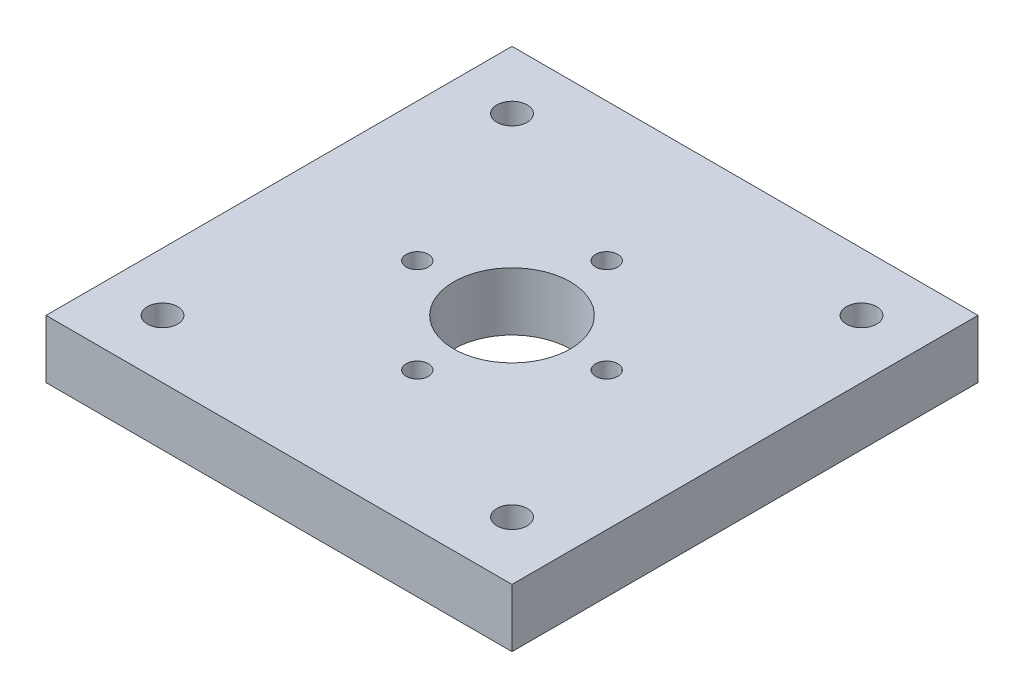
from build123d import *

# Parameters (mm, degrees)
SKETCH1_W           = 4
SKETCH1_H           = 4
BOSS_EXTRUDE1_DEPTH = 0.5
SKETCH2_R           = 0.13
CUT_EXTRUDE1_DEPTH  = 0.5
SKETCH3_R           = 0.5
CUT_EXTRUDE2_DEPTH  = 0.5
SKETCH4_R           = 0.095
CUT_EXTRUDE3_DEPTH  = 3.872281323
CIRPATTERN1_COUNT   = 4


with BuildPart() as part:
    # Sketch1 → Boss-Extrude1 (new body)
    with BuildSketch(Plane(origin=(0, 0, 0), x_dir=(1, 0, 0), z_dir=(0, 1, 0))):
        Rectangle(SKETCH1_W, SKETCH1_H)
    extrude(amount=BOSS_EXTRUDE1_DEPTH)

    # Sketch2 → Cut-Extrude1 (cut)
    with BuildSketch(Plane(origin=(0, 0.5, 0), x_dir=(1, 0, 0), z_dir=(0, 1, 0))):
        with Locations(Location((-1.5, -1.5, 0), (0, 0, 270))):
            Circle(SKETCH2_R)
        with Locations(Location((1.5, -1.5, 0), (0, 0, 270))):
            Circle(SKETCH2_R)
        with Locations(Location((1.5, 1.5, 0), (0, 0, 90))):
            Circle(SKETCH2_R)
        with Locations(Location((-1.5, 1.5, 0), (0, 0, 90))):
            Circle(SKETCH2_R)
    extrude(amount=-CUT_EXTRUDE1_DEPTH, mode=Mode.SUBTRACT)

    # Sketch3 → Cut-Extrude2 (cut)
    with BuildSketch(Plane.XZ):
        with Locations(Location((0, 0, 0), (0, 0, 270))):
            Circle(SKETCH3_R)
    extrude(amount=-CUT_EXTRUDE2_DEPTH, mode=Mode.SUBTRACT)

    # Sketch4 → Cut-Extrude3 (cut, through all)
    with BuildSketch(Plane.XZ):
        with Locations(Location((0, 0.813, 0), (0, 0, 270))):
            Circle(SKETCH4_R)
    cut_extrude3 = extrude(amount=-CUT_EXTRUDE3_DEPTH, mode=Mode.SUBTRACT)

    # CirPattern1: Cut-Extrude3 ×4 about axis
    cirpattern1_axis = Axis((0, 0, 0), (0, 1, 0))
    for i in range(1, CIRPATTERN1_COUNT):
        add(cut_extrude3.rotate(cirpattern1_axis, i * 360 / CIRPATTERN1_COUNT), mode=Mode.SUBTRACT)


solid = part.part
